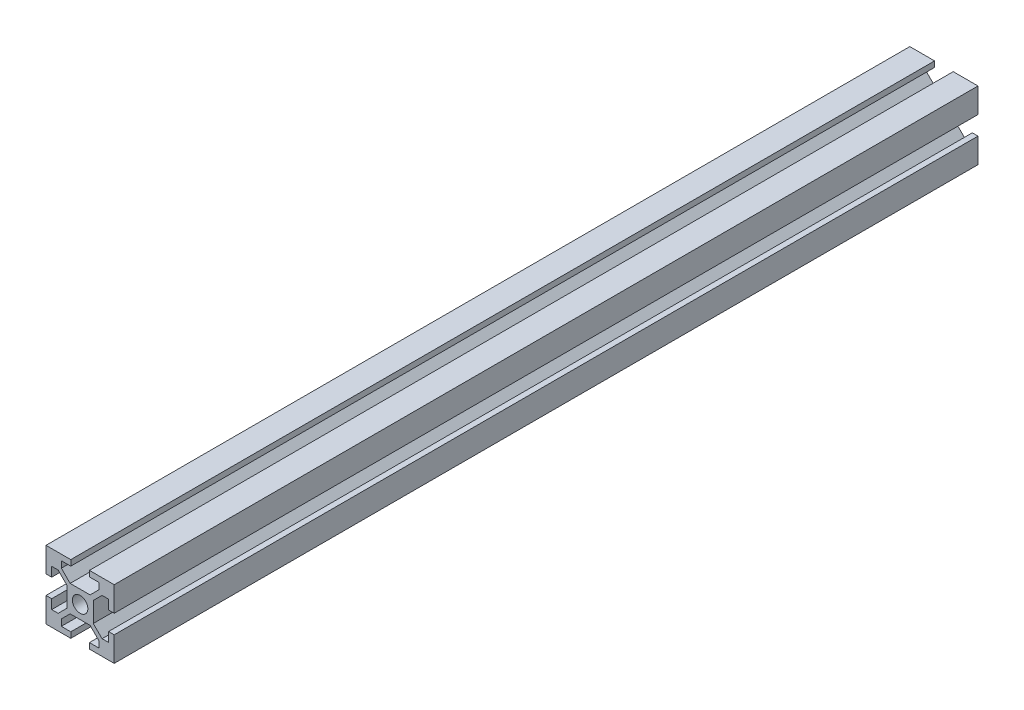
from build123d import *

# Parameters (mm, degrees)
SKETCH_1_R      = 3.4
EXTRUDE_1_DEPTH = 380


with BuildPart() as part:
    # 草图1 → 凸台-拉伸1 (new body)
    with BuildSketch(Plane.XY):
        Polygon((-4.1, 12.5), (-4.1, 15), (-8.25, 15), (-15, 15), (-15, 8.25), (-15, 4.1), (-12.5, 4.1), (-12.5, 8.25), (-9.664213562, 8.25), (-5.8, 4.385786438), (-5.8, -4.385786438), (-9.664213562, -8.25), (-12.5, -8.25), (-12.5, -4.1), (-15, -4.1), (-15, -8.25), (-15, -15), (-8.25, -15), (-4.1, -15), (-4.1, -12.5), (-8.25, -12.5), (-8.25, -9.664213562), (-4.385786438, -5.8), (4.385786438, -5.8), (8.25, -9.664213562), (8.25, -12.5), (4.1, -12.5), (4.1, -15), (8.25, -15), (15, -15), (15, -8.25), (15, -4.1), (12.5, -4.1), (12.5, -8.25), (9.664213562, -8.25), (5.8, -4.385786438), (5.8, 4.385786438), (9.664213562, 8.25), (12.5, 8.25), (12.5, 4.1), (15, 4.1), (15, 8.25), (15, 15), (8.25, 15), (4.1, 15), (4.1, 12.5), (8.25, 12.5), (8.25, 9.664213562), (4.385786438, 5.8), (-4.385786438, 5.8), (-8.25, 9.664213562), (-8.25, 12.5), align=None)
        Circle(SKETCH_1_R, mode=Mode.SUBTRACT)
    extrude(amount=EXTRUDE_1_DEPTH)


solid = part.part
